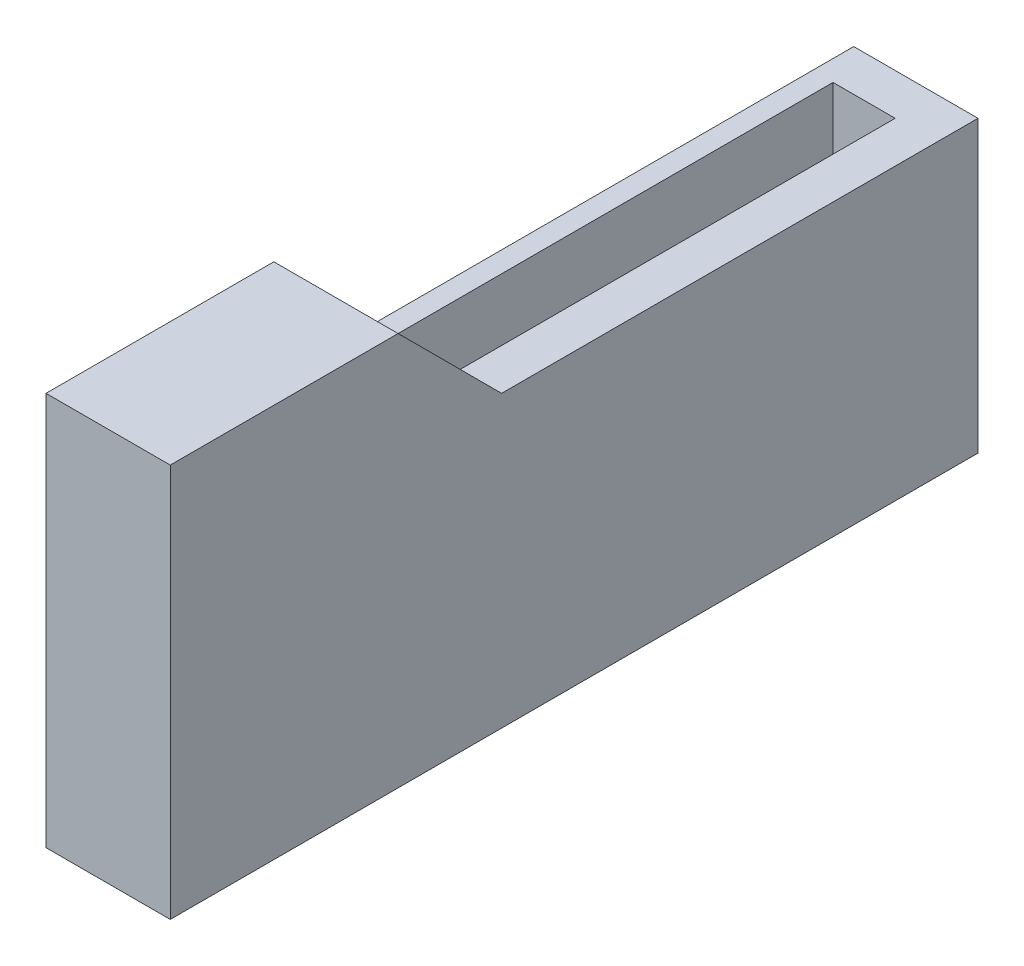
from build123d import *

# Parameters (mm, degrees)
EXTRUDE_2_DEPTH = 14
SKETCH_3_W      = 6
SKETCH_3_H      = 16
EXTRUDE_3_DEPTH = 5
CHAMFER_1_SIZE  = 5


with BuildPart() as part:
    # Эскиз1 → Бобышка-Вытянуть2 (new body)
    with BuildSketch(Plane(origin=(0, 0, 0), x_dir=(1, 0, 0), z_dir=(0, 1, 0))):
        Polygon((-2.5, -26.5), (-1.5, -26.5), (3.5, -26.5), (3.5, -12.5), (3.5, -7.973274813), (3.5, 12.5), (-1.5, 12.5), (-2.5, 12.5), align=None)
        Polygon((1.5, -10.5), (-1.5, -10.5), (-1.5, -5.357142857), (-1.5, 5.357142857), (-1.5, 10.5), (1.5, 10.5), align=None, mode=Mode.SUBTRACT)
    extrude(amount=EXTRUDE_2_DEPTH)

    # Эскиз3 → Бобышка-Вытянуть3 (add)
    with BuildSketch(Plane(origin=(0, 14, 0), x_dir=(1, 0, 0), z_dir=(0, 1, 0))):
        with Locations((0.5, -18.5)):
            Rectangle(SKETCH_3_W, SKETCH_3_H)
    extrude(amount=EXTRUDE_3_DEPTH)

    # Фаска1
    chamfer_1_edges = [part.edges().sort_by_distance(p)[0] for p in [
        (0.5, 19, 10.5),
    ]]
    chamfer(chamfer_1_edges, length=CHAMFER_1_SIZE)


solid = part.part
